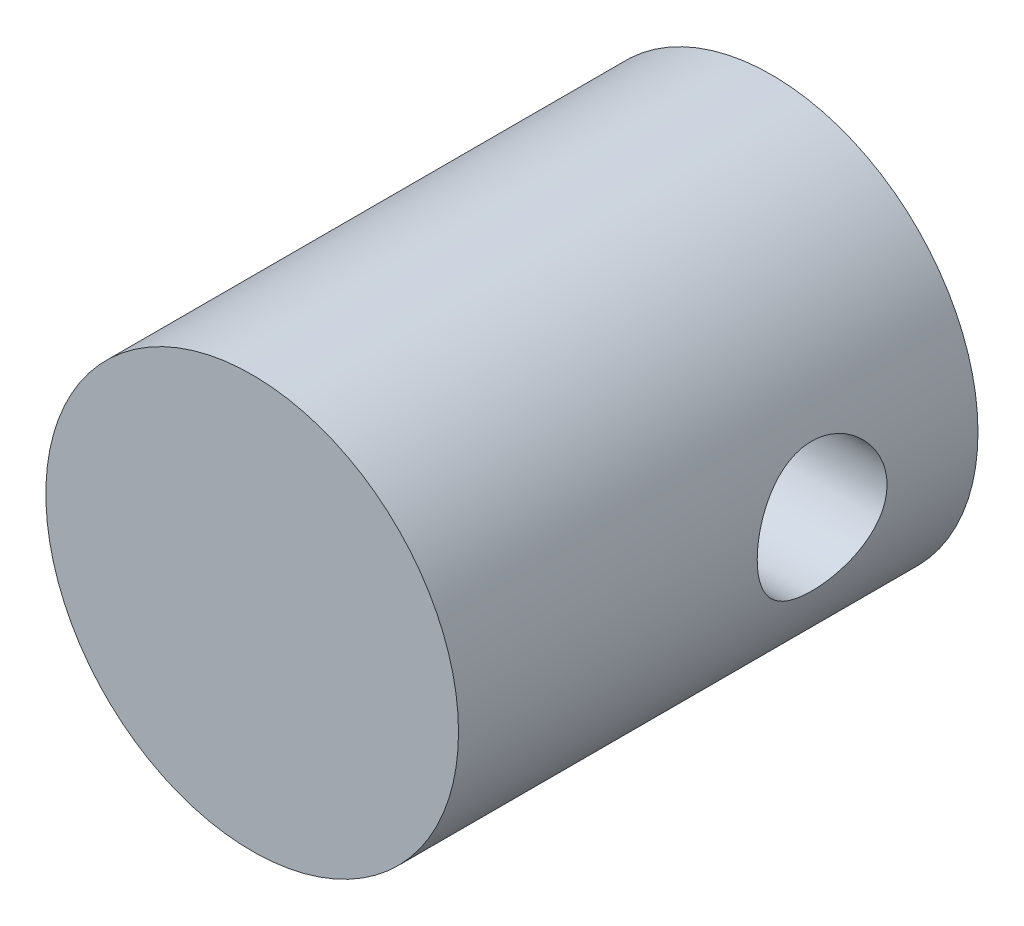
from build123d import *

# Parameters (mm, degrees)
SKETCH1_R               = 12.6111
BOSS_EXTRUDE1_DEPTH     = 31.75
CUT_EXTRUDE1_DEPTH      = 37.416235204
CUT_EXTRUDE1_DEPTH_BACK = 37.416235204
SKETCH2_R               = 3.96875


with BuildPart() as part:
    # Sketch1 → Boss-Extrude1 (new body)
    with BuildSketch(Plane(origin=(0, 0, 0), x_dir=(0, 1, 0), z_dir=(0, 0, 1))):
        with Locations(Location((0, 0, 0), (0, 0, 270))):
            Circle(SKETCH1_R)
    extrude(amount=BOSS_EXTRUDE1_DEPTH)

    # Sketch2 → Cut-Extrude1 (cut, two sides: drawn at the far end of the back side and taken through both)
    with BuildSketch(Plane.YZ.offset(-CUT_EXTRUDE1_DEPTH_BACK)):
        with Locations(Location((0, 9.525, 0), (0, 0, 270))):
            Circle(SKETCH2_R)
    extrude(amount=CUT_EXTRUDE1_DEPTH + CUT_EXTRUDE1_DEPTH_BACK, mode=Mode.SUBTRACT)


solid = part.part
